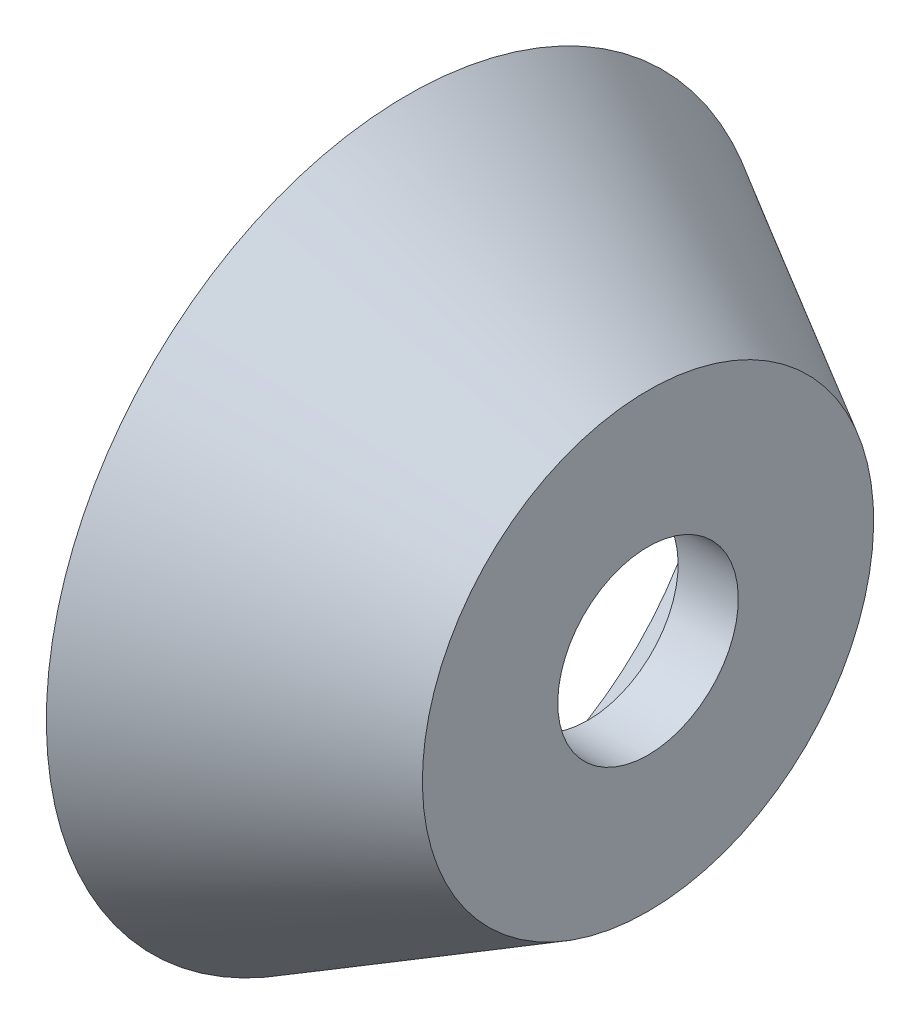
from build123d import *


with BuildPart() as part:
    # Sketch1 → Revolve1 (revolve)
    with BuildSketch(Plane.XY, mode=Mode.PRIVATE) as revolve1_sk:
        Polygon((3.175, 4.7625), (6.35, 4.7625), (6.35, 11.90625), (-6.35, 19.05), (-4.233333333, 14.216546737), (3.175, 10.049359237), align=None)
    revolve(revolve1_sk.sketch.rotate(Axis((-6.35, 0, 0), (1, 0, 0)), 180), axis=Axis((-6.35, 0, 0), (1, 0, 0)))


solid = part.part
